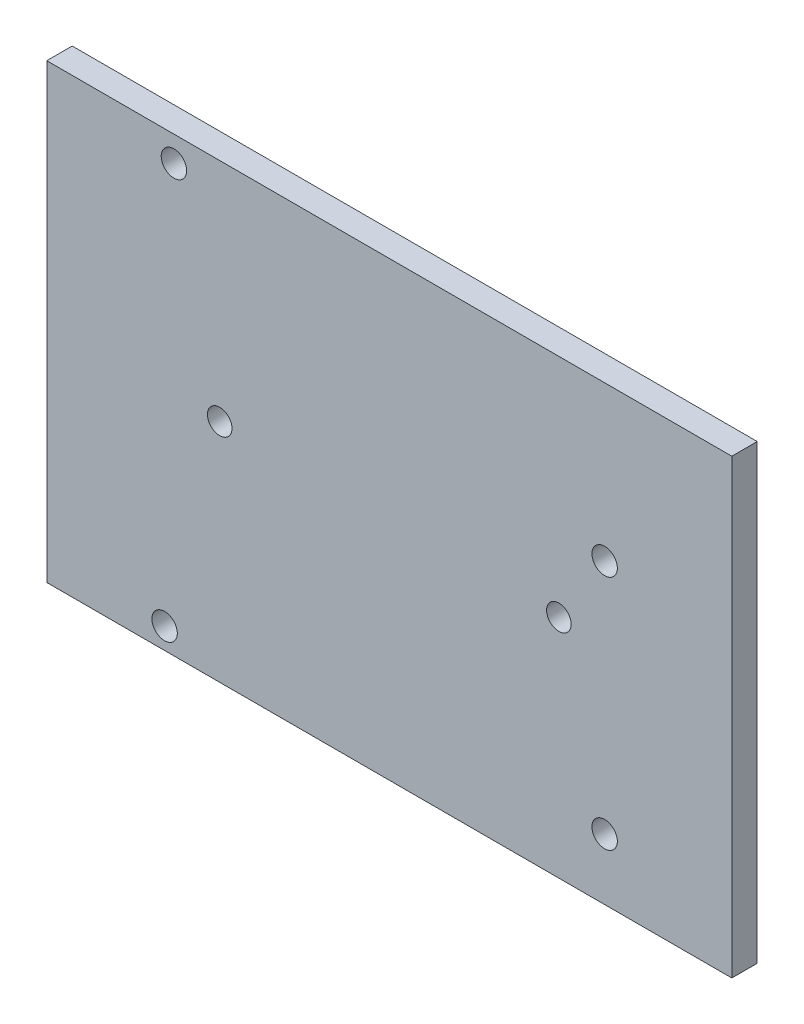
from build123d import *

# Parameters (mm, degrees)
SKETCH1_W           = 80.8
SKETCH1_H           = 53.3
SKETCH1_R           = 1.5
SKETCH1_R_2         = 1.45
BOSS_EXTRUDE1_DEPTH = 3


with BuildPart() as part:
    # Sketch1 → Boss-Extrude1 (new body)
    with BuildSketch(Plane.XY):
        Rectangle(SKETCH1_W, SKETCH1_H)
        with Locations((-25.4, 23.65)):
            Circle(SKETCH1_R, mode=Mode.SUBTRACT)
        with Locations((-26.5, -24.15)):
            Circle(SKETCH1_R, mode=Mode.SUBTRACT)
        with Locations((25.4, -19.45)):
            Circle(SKETCH1_R, mode=Mode.SUBTRACT)
        with Locations((25.4, 8.45)):
            Circle(SKETCH1_R, mode=Mode.SUBTRACT)
        with Locations((20, 0)):
            Circle(SKETCH1_R_2, mode=Mode.SUBTRACT)
        with Locations((-20, 0)):
            Circle(SKETCH1_R_2, mode=Mode.SUBTRACT)
    extrude(amount=BOSS_EXTRUDE1_DEPTH)


solid = part.part
